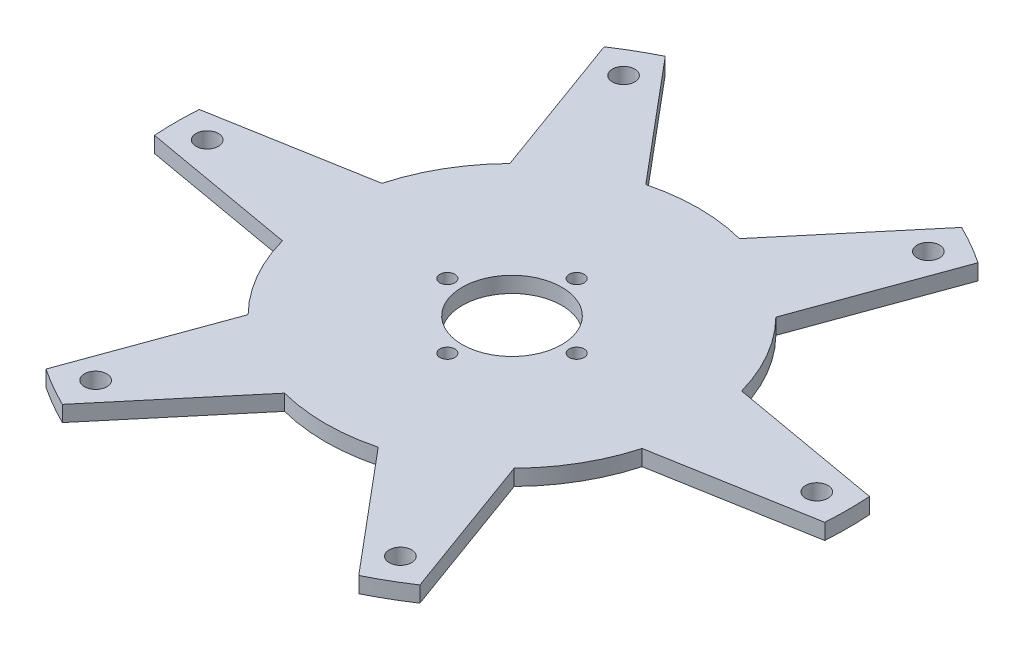
from build123d import *

# Parameters (mm, degrees)
SKETCH2_R           = 10
SKETCH2_R_2         = 1.5
SKETCH2_R_3         = 2.25
BOSS_EXTRUDE1_DEPTH = 3.175


with BuildPart() as part:
    # Sketch2 → Boss-Extrude1 (new body)
    with BuildSketch(Plane(origin=(0, 0, 0), x_dir=(1, 0, 0), z_dir=(0, 1, 0))):
        with BuildLine():
            Line((-36.142080737, 10), (-67.350020101, 4.497198278))
            ThreePointArc((-67.350020101, 4.497198278), (-67.5, 0), (-67.350020101, -4.497198278))
            Line((-67.350020101, -4.497198278), (-36.142080737, -10))
            ThreePointArc((-36.142080737, -10), (-32.475952642, -18.75), (-26.731294406, -26.299960064))
            Line((-26.731294406, -26.299960064), (-37.569698005, -56.078229214))
            ThreePointArc((-37.569698005, -56.078229214), (-33.75, -58.456714755), (-29.780322096, -60.575427492))
            Line((-29.780322096, -60.575427492), (-9.410786331, -36.299960064))
            ThreePointArc((-9.410786331, -36.299960064), (0, -37.5), (9.410786331, -36.299960064))
            Line((9.410786331, -36.299960064), (29.780322096, -60.575427492))
            ThreePointArc((29.780322096, -60.575427492), (33.75, -58.456714755), (37.569698005, -56.078229214))
            Line((37.569698005, -56.078229214), (26.731294406, -26.299960064))
            ThreePointArc((26.731294406, -26.299960064), (32.475952642, -18.75), (36.142080737, -10))
            Line((36.142080737, -10), (67.350020101, -4.497198278))
            ThreePointArc((67.350020101, -4.497198278), (67.5, 0), (67.350020101, 4.497198278))
            Line((67.350020101, 4.497198278), (36.142080737, 10))
            ThreePointArc((36.142080737, 10), (32.475952642, 18.75), (26.731294406, 26.299960064))
            Line((26.731294406, 26.299960064), (37.569698005, 56.078229214))
            ThreePointArc((37.569698005, 56.078229214), (33.75, 58.456714755), (29.780322096, 60.575427492))
            Line((29.780322096, 60.575427492), (9.410786331, 36.299960064))
            ThreePointArc((9.410786331, 36.299960064), (0, 37.5), (-9.410786331, 36.299960064))
            Line((-9.410786331, 36.299960064), (-29.780322096, 60.575427492))
            ThreePointArc((-29.780322096, 60.575427492), (-33.75, 58.456714755), (-37.569698005, 56.078229214))
            Line((-37.569698005, 56.078229214), (-26.731294406, 26.299960064))
            ThreePointArc((-26.731294406, 26.299960064), (-32.475952642, 18.75), (-36.142080737, 10))
        make_face()
        with Locations(Location((0, 0, 0), (0, 0, 270))):
            Circle(SKETCH2_R, mode=Mode.SUBTRACT)
        with Locations(Location((0, 13, 0), (0, 0, 270))):
            Circle(SKETCH2_R_2, mode=Mode.SUBTRACT)
        with Locations(Location((13, 0, 0), (0, 0, 270))):
            Circle(SKETCH2_R_2, mode=Mode.SUBTRACT)
        with Locations(Location((0, -13, 0), (0, 0, 270))):
            Circle(SKETCH2_R_2, mode=Mode.SUBTRACT)
        with Locations(Location((-13, 0, 0), (0, 0, 270))):
            Circle(SKETCH2_R_2, mode=Mode.SUBTRACT)
        with Locations(Location((-61.25, 0, 0), (0, 0, 270))):
            Circle(SKETCH2_R_3, mode=Mode.SUBTRACT)
        with Locations(Location((-30.625, 53.044055982, 0), (0, 0, 270))):
            Circle(SKETCH2_R_3, mode=Mode.SUBTRACT)
        with Locations(Location((30.625, 53.044055982, 0), (0, 0, 270))):
            Circle(SKETCH2_R_3, mode=Mode.SUBTRACT)
        with Locations(Location((61.25, 0, 0), (0, 0, 270))):
            Circle(SKETCH2_R_3, mode=Mode.SUBTRACT)
        with Locations(Location((30.625, -53.044055982, 0), (0, 0, 270))):
            Circle(SKETCH2_R_3, mode=Mode.SUBTRACT)
        with Locations(Location((-30.625, -53.044055982, 0), (0, 0, 270))):
            Circle(SKETCH2_R_3, mode=Mode.SUBTRACT)
    extrude(amount=BOSS_EXTRUDE1_DEPTH)


solid = part.part
